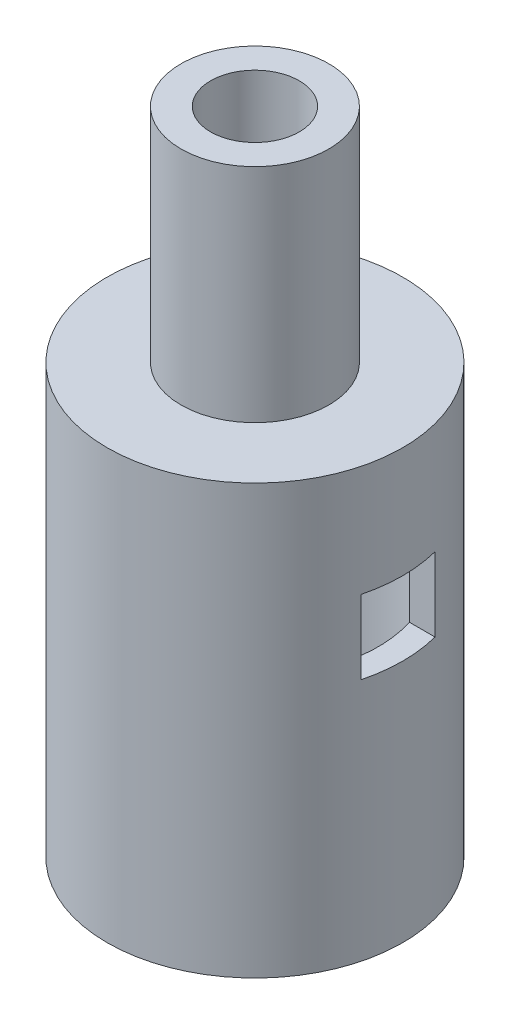
from build123d import *

# Parameters (mm, degrees)
SKETCH2_R                = 7.62
BOSS_EXTRUDE1_DEPTH      = 22.098
SKETCH3_R                = 6.35
CUT_EXTRUDE1_DEPTH       = 16.764
CUT_EXTRUDE3_DEPTH       = 16.764
CUT_EXTRUDE3_DEPTH_BACK  = 25.585573087
SKETCH5_R                = 2.3495
SKETCH6_R                = 3.81
BOSS_EXTRUDE2_DEPTH      = 11.43
SKETCH8_R                = 2.286
CUT_EXTRUDE4_DEPTH       = 11.176
CUT_EXTRUDE8_REACH       = 26.586
SKETCH10_R               = 1.719833609
CUT_EXTRUDE10_DEPTH      = 25.585573087
CUT_EXTRUDE10_DEPTH_BACK = 25.585573087
SKETCH12_W               = 3.81
SKETCH12_H               = 3.81


with BuildPart() as part:
    # Sketch2 → Boss-Extrude1 (new body)
    with BuildSketch(Plane(origin=(0, 0, 0), x_dir=(1, 0, 0), z_dir=(0, 1, 0))):
        with Locations(Location((0, 0, 0), (0, 0, 270))):
            Circle(SKETCH2_R)
    extrude(amount=-BOSS_EXTRUDE1_DEPTH)

    # Sketch3 → Cut-Extrude1 (cut)
    with BuildSketch(Plane.XZ.offset(22.098)):
        with Locations(Location((0, 0, 0), (0, 0, 270))):
            Circle(SKETCH3_R)
    extrude(amount=-CUT_EXTRUDE1_DEPTH, mode=Mode.SUBTRACT)

    # Sketch5 → Cut-Extrude3 (cut, two sides: drawn at the far end of the back side and taken through both)
    with BuildSketch(Plane(origin=(0, 0, 0), x_dir=(1, 0, 0), z_dir=(0, 1, 0)).offset(-CUT_EXTRUDE3_DEPTH_BACK)):
        with Locations(Location((0, 0, 0), (0, 0, 270))):
            Circle(SKETCH5_R)
    extrude(amount=CUT_EXTRUDE3_DEPTH + CUT_EXTRUDE3_DEPTH_BACK, mode=Mode.SUBTRACT)

    # Sketch6 → Boss-Extrude2 (add)
    with BuildSketch(Plane(origin=(0, 0, 0), x_dir=(1, 0, 0), z_dir=(0, 1, 0))):
        with Locations(Location((0, 0, 0), (0, 0, 270))):
            Circle(SKETCH6_R)
    extrude(amount=BOSS_EXTRUDE2_DEPTH)

    # Sketch8 → Cut-Extrude4 (cut)
    with BuildSketch(Plane(origin=(0, 11.43, 0), x_dir=(1, 0, 0), z_dir=(0, 1, 0))):
        with Locations(Location((0, 0, 0), (0, 0, 270))):
            Circle(SKETCH8_R)
    extrude(amount=-CUT_EXTRUDE4_DEPTH, mode=Mode.SUBTRACT)

    # Sketch10 → Cut-Extrude8 (cut, up to next)
    with BuildSketch(Plane.XZ, mode=Mode.PRIVATE) as cut_extrude8_sk1:
        with Locations(Location((0, 0, 0), (0, 0, 270))):
            Circle(SKETCH10_R)
    cut_extrude8_tool1 = extrude(cut_extrude8_sk1.sketch, amount=-CUT_EXTRUDE8_REACH, mode=Mode.PRIVATE) & part.part
    add(cut_extrude8_tool1.solids().sort_by_distance((0, 0, 0))[0], mode=Mode.SUBTRACT)

    # Sketch12 → Cut-Extrude10 (cut, two sides: drawn at the far end of the back side and taken through both)
    with BuildSketch(Plane(origin=(0, 0, 0), x_dir=(0, 0, -1), z_dir=(1, 0, 0)).offset(-CUT_EXTRUDE10_DEPTH_BACK)):
        with Locations((0, -7.62)):
            Rectangle(SKETCH12_W, SKETCH12_H)
    extrude(amount=CUT_EXTRUDE10_DEPTH + CUT_EXTRUDE10_DEPTH_BACK, mode=Mode.SUBTRACT)


solid = part.part
